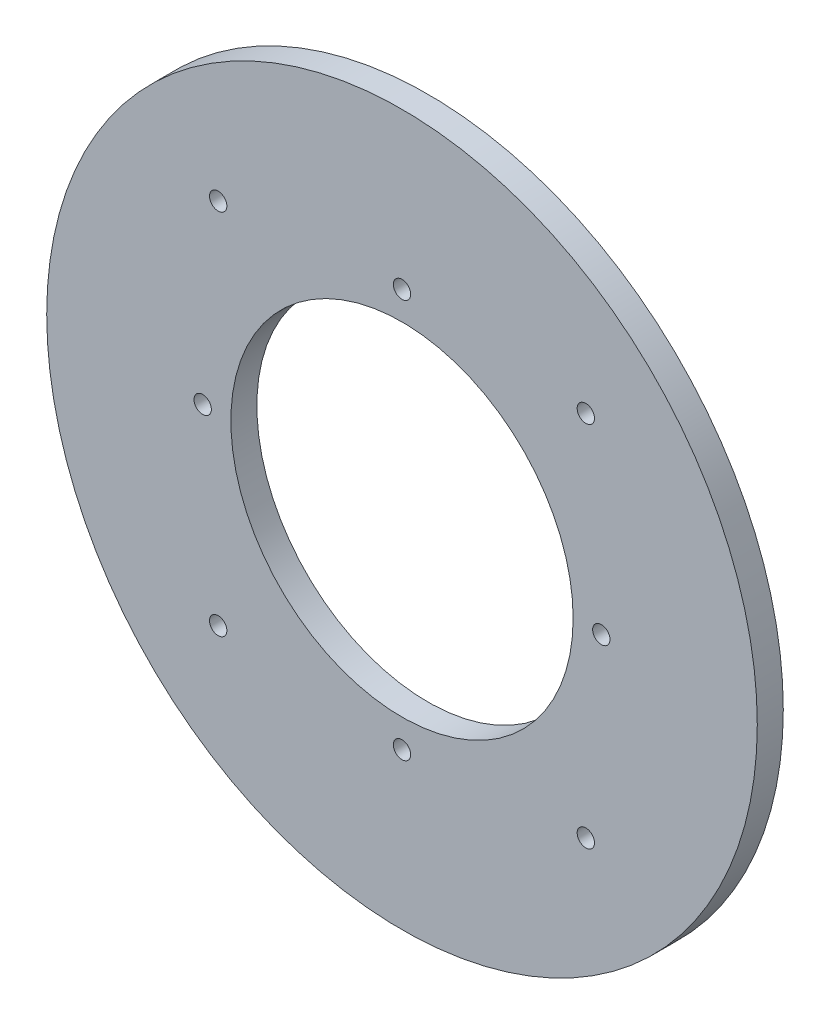
from build123d import *

# Parameters (mm, degrees)
SKETCH1_R           = 82
SKETCH1_R_2         = 39.5
BOSS_EXTRUDE1_DEPTH = 6
SKETCH2_R           = 2
CUT_EXTRUDE1_DEPTH  = 10
CIRPATTERN1_COUNT   = 4
SKETCH3_R           = 2
CUT_EXTRUDE2_DEPTH  = 10


with BuildPart() as part:
    # Sketch1 → Boss-Extrude1 (new body)
    with BuildSketch(Plane.XY):
        Circle(SKETCH1_R)
        Circle(SKETCH1_R_2, mode=Mode.SUBTRACT)
    extrude(amount=BOSS_EXTRUDE1_DEPTH)

    # Sketch2 → Cut-Extrude1 (cut)
    with BuildSketch(Plane.XY.offset(6)):
        with Locations((42.426406871, 42.426406871)):
            Circle(SKETCH2_R)
    cut_extrude1 = extrude(amount=-CUT_EXTRUDE1_DEPTH, mode=Mode.SUBTRACT)

    # CirPattern1: Cut-Extrude1 ×4 about axis
    cirpattern1_axis = Axis((0, 0, 0), (0, 0, 1))
    for i in range(1, CIRPATTERN1_COUNT):
        add(cut_extrude1.rotate(cirpattern1_axis, i * 360 / CIRPATTERN1_COUNT), mode=Mode.SUBTRACT)

    # Sketch3 → Cut-Extrude2 (cut)
    with BuildSketch(Plane.XY.offset(6)):
        with Locations((0, 46)):
            Circle(SKETCH3_R)
        with Locations((46, 0)):
            Circle(SKETCH3_R)
        with Locations((0, -46)):
            Circle(SKETCH3_R)
        with Locations((-46, 0)):
            Circle(SKETCH3_R)
    extrude(amount=-CUT_EXTRUDE2_DEPTH, mode=Mode.SUBTRACT)


solid = part.part
